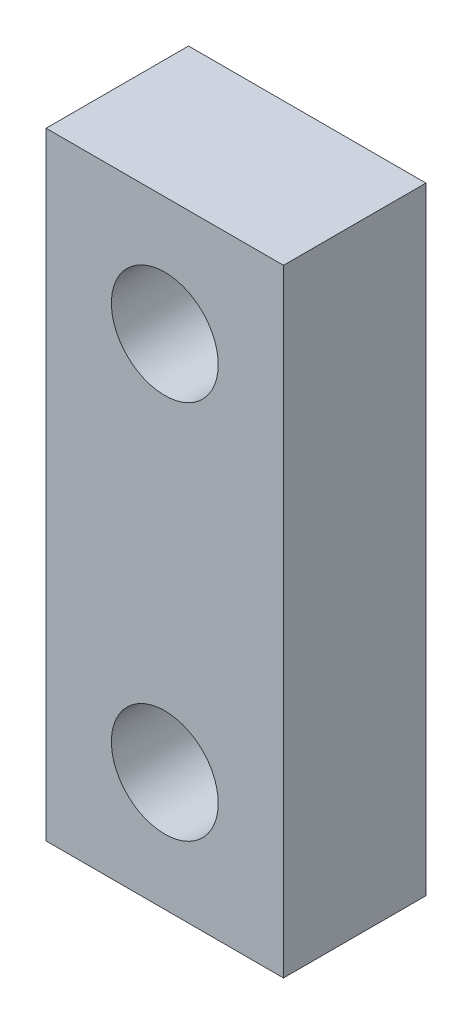
from build123d import *

# Parameters (mm, degrees)
SKETCH1_W           = 10
SKETCH1_H           = 26
BOSS_EXTRUDE1_DEPTH = 6
SKETCH2_R           = 2.25
CUT_EXTRUDE1_DEPTH  = 16.165750888


with BuildPart() as part:
    # Sketch1 → Boss-Extrude1 (new body)
    with BuildSketch(Plane.XY):
        Rectangle(SKETCH1_W, SKETCH1_H)
    extrude(amount=BOSS_EXTRUDE1_DEPTH)

    # Sketch2 → Cut-Extrude1 (cut, through all)
    with BuildSketch(Plane.XY.offset(6)):
        with Locations((0, 8)):
            Circle(SKETCH2_R)
        with Locations((0, -8)):
            Circle(SKETCH2_R)
    extrude(amount=-CUT_EXTRUDE1_DEPTH, mode=Mode.SUBTRACT)


solid = part.part
